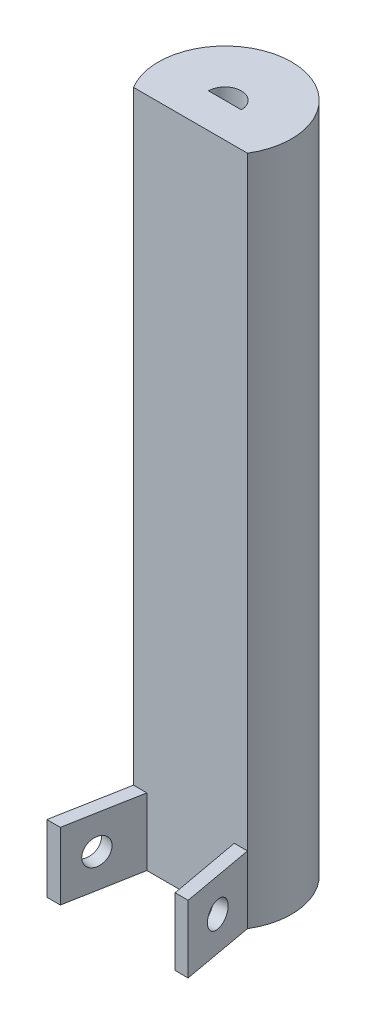
from build123d import *

# Parameters (mm, degrees)
SKETCH1_R           = 12.62515314
BOSS_EXTRUDE1_DEPTH = 127.254
SKETCH2_W           = 21.600890372
SKETCH2_H           = 6.08719661
CUT_EXTRUDE1_DEPTH  = 155.702
CUT_EXTRUDE2_DEPTH  = 141.081655767
BOSS_EXTRUDE2_DEPTH = 12.755190121
BOSS_EXTRUDE3_DEPTH = 12.755190121
SKETCH6_R           = 2.435016118
CUT_EXTRUDE3_DEPTH  = 11.231190121
SKETCH7_R           = 2.472305811
CUT_EXTRUDE4_DEPTH  = 10.977190121


with BuildPart() as part:
    # Sketch1 → Boss-Extrude1 (new body)
    with BuildSketch(Plane(origin=(0, 0, 0), x_dir=(1, 0, 0), z_dir=(0, 1, 0))):
        with Locations(Location((0, 0, 0), (0, 0, 270))):
            Circle(SKETCH1_R)
    extrude(amount=-BOSS_EXTRUDE1_DEPTH)

    # Sketch2 → Cut-Extrude1 (cut)
    with BuildSketch(Plane(origin=(0, -127.254, 0), x_dir=(-1, 0, 0), z_dir=(0, -1, 0))):
        with Locations((0, -9.581554835)):
            Rectangle(SKETCH2_W, SKETCH2_H)
    extrude(amount=-CUT_EXTRUDE1_DEPTH, mode=Mode.SUBTRACT)

    # Sketch3 → Cut-Extrude2 (cut)
    with BuildSketch(Plane(origin=(0, -127.254, 0), x_dir=(-1, 0, 0), z_dir=(0, -1, 0))):
        with BuildLine():
            Line((3.126169088, 0), (-3.091625783, 0))
            ThreePointArc((-3.091625783, 0), (0.017271652, 3.108897435), (3.126169088, 0))
        make_face()
    extrude(amount=-CUT_EXTRUDE2_DEPTH, mode=Mode.SUBTRACT)

    # Sketch4 → Boss-Extrude2 (add)
    with BuildSketch(Plane.XZ.offset(127.254)):
        Polygon((-10.800445186, 6.53795653), (-8.274777075, 6.53795653), (-10.800445186, 20.396051451), (-13.364649969, 20.396051451), align=None)
    extrude(amount=-BOSS_EXTRUDE2_DEPTH)

    # Sketch5 → Boss-Extrude3 (add)
    with BuildSketch(Plane.XZ.offset(127.254)):
        Polygon((10.800445186, 6.53795653), (8.287884941, 6.53795653), (10.800445186, 20.258509361), (13.265579683, 20.258509361), align=None)
    extrude(amount=-BOSS_EXTRUDE3_DEPTH)

    # Sketch6 → Cut-Extrude3 (cut)
    with BuildSketch(Plane(origin=(9.324781226, 0, -1.67535814), x_dir=(-0.17683579611178707, 0, -0.9842403676000647), z_dir=(0.9842403676000648, 0, -0.17683579611178707))):
        with Locations((-15.314949053, -120.83230441)):
            Circle(SKETCH6_R)
    extrude(amount=-CUT_EXTRUDE3_DEPTH, mode=Mode.SUBTRACT)

    # Sketch7 → Cut-Extrude4 (cut)
    with BuildSketch(Plane(origin=(-9.273218408, 0, -1.715851358), x_dir=(-0.18194456837394912, 0, 0.9833087887531655), z_dir=(-0.9833087887531655, 0, -0.18194456837394912))):
        with Locations((16.069302572, -120.876404939)):
            Circle(SKETCH7_R)
    extrude(amount=-CUT_EXTRUDE4_DEPTH, mode=Mode.SUBTRACT)


solid = part.part
